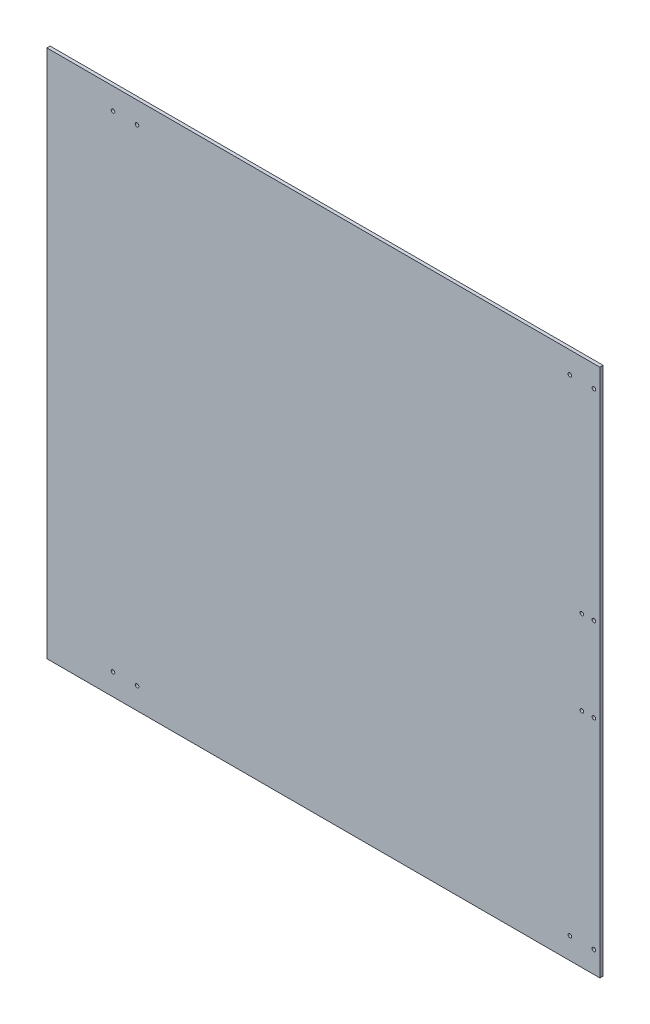
from build123d import *

# Parameters (mm, degrees)
SKETCH_1_W          = 460
SKETCH_1_H          = 440
EXTRUDE_1_DEPTH     = 2.7
SKETCH_2_R          = 1.5
CUT_EXTRUDE_1_DEPTH = 10
SKETCH_3_R          = 1.5
CUT_EXTRUDE_2_DEPTH = 10


with BuildPart() as part:
    # 草图1 → 凸台-拉伸1 (new body)
    with BuildSketch(Plane.XY):
        with Locations((-230, 220)):
            Rectangle(SKETCH_1_W, SKETCH_1_H)
    extrude(amount=EXTRUDE_1_DEPTH)

    # 草图2 → 切除-拉伸1 (cut)
    with BuildSketch(Plane.XY.offset(2.7)):
        with Locations((-5, 422)):
            Circle(SKETCH_2_R)
        with Locations((-25, 422)):
            Circle(SKETCH_2_R)
        with Locations((-25, 18)):
            Circle(SKETCH_2_R)
        with Locations((-5, 18)):
            Circle(SKETCH_2_R)
        with Locations((-385, 422)):
            Circle(SKETCH_2_R)
        with Locations((-405, 422)):
            Circle(SKETCH_2_R)
        with Locations((-405, 18)):
            Circle(SKETCH_2_R)
        with Locations((-385, 18)):
            Circle(SKETCH_2_R)
    extrude(amount=-CUT_EXTRUDE_1_DEPTH, mode=Mode.SUBTRACT)

    # 草图3 → 切除-拉伸2 (cut)
    with BuildSketch(Plane.XY.offset(2.7)):
        with Locations((-15, 255)):
            Circle(SKETCH_3_R)
        with Locations((-5, 255)):
            Circle(SKETCH_3_R)
        with Locations((-5, 185)):
            Circle(SKETCH_3_R)
        with Locations((-15, 185)):
            Circle(SKETCH_3_R)
    extrude(amount=-CUT_EXTRUDE_2_DEPTH, mode=Mode.SUBTRACT)


solid = part.part
